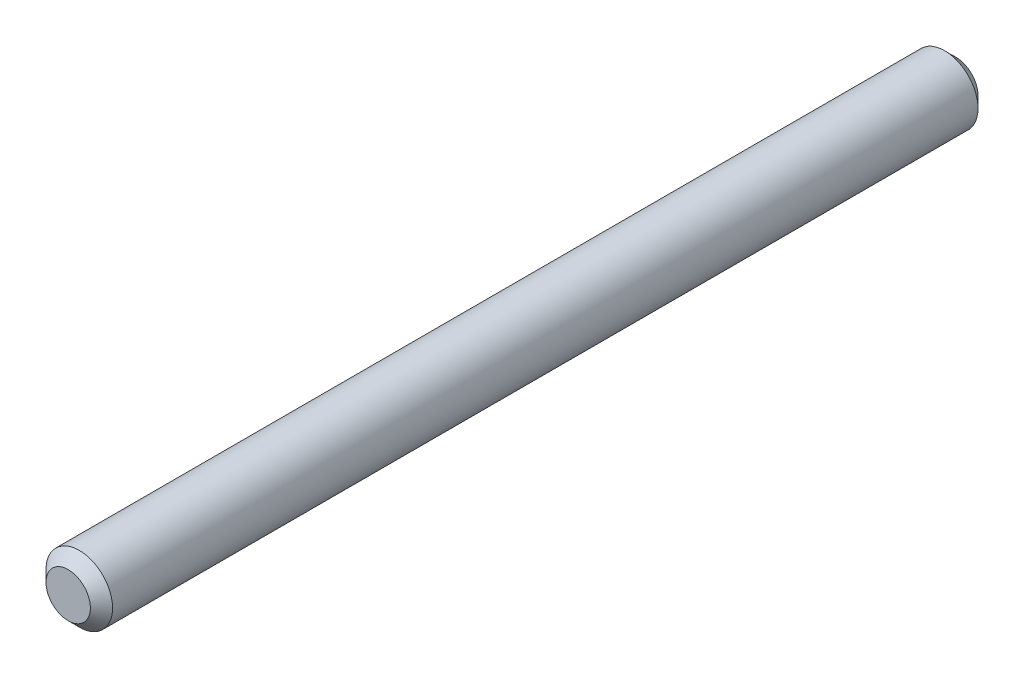
from build123d import *

# Parameters (mm, degrees)
SZKIC1_R                    = 3
DODANIE_WYCI_GNI_CIE1_DEPTH = 40
SFAZOWANIE1_SIZE            = 1


with BuildPart() as part:
    # Szkic1 → Dodanie-wyciągnięcie1 (new, symmetric)
    with BuildSketch(Plane.XY):
        Circle(SZKIC1_R)
    extrude(amount=DODANIE_WYCI_GNI_CIE1_DEPTH, both=True)

    # Sfazowanie1
    sfazowanie1_edges = [part.edges().sort_by_distance(p)[0] for p in [
        (-3, 0, -40),
        (-3, 0, 40),
    ]]
    chamfer(sfazowanie1_edges, length=SFAZOWANIE1_SIZE)


solid = part.part
